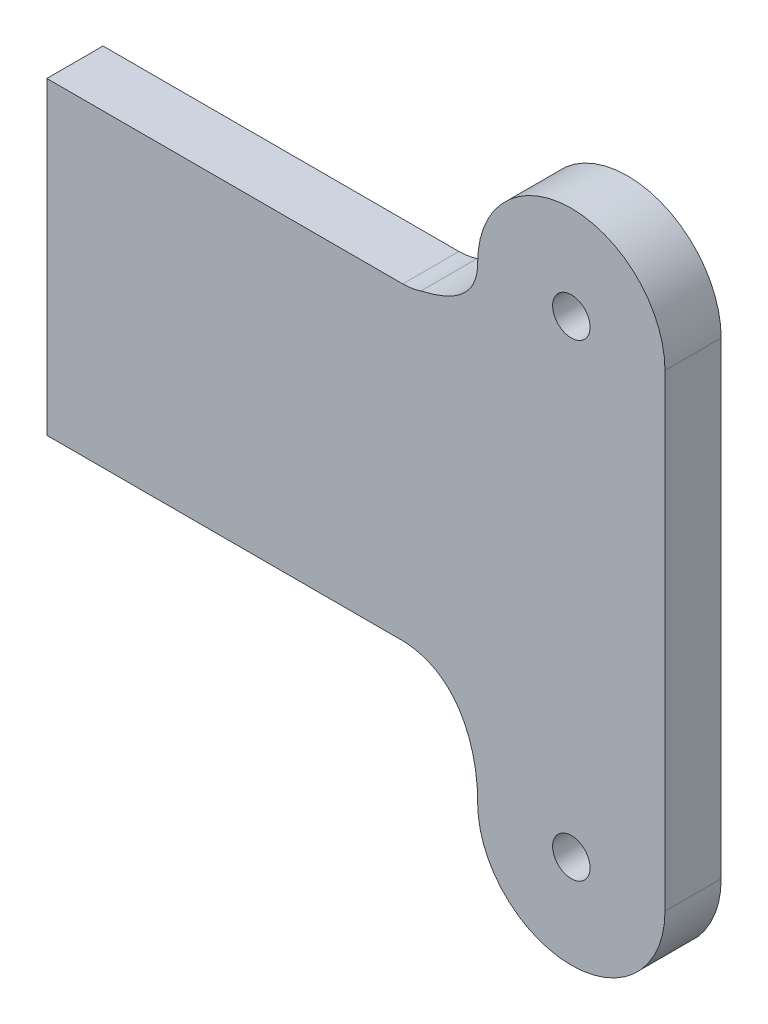
from build123d import *

# Parameters (mm, degrees)
SKETCH1_R           = 1
BOSS_EXTRUDE1_DEPTH = 3
SKETCH5_OUTSIDE_W   = 34.508
SKETCH5_OUTSIDE_H   = 45.508
SKETCH5_OUTSIDE_R   = 1
CUT_EXTRUDE2_DEPTH  = 10
SKETCH7_W           = 3
SKETCH7_H           = 10
SKETCH7_H_2         = 4
BOSS_EXTRUDE2_DEPTH = 10
BOSS_EXTRUDE3_REACH = 32.956
SKETCH8_W           = 22
SKETCH8_H           = 3


with BuildPart() as part:
    # Sketch1 → Boss-Extrude1 (new body)
    with BuildSketch(Plane.XY):
        with BuildLine():
            Line((0, 0), (0, -10))
            Line((0, -10), (9, -10))
            ThreePointArc((9, -10), (11.121320344, -10.878679656), (12, -13))
            Line((12, -13), (12, -17.5))
            ThreePointArc((12, -17.5), (12.878679656, -19.621320344), (15, -20.5))
            Line((15, -20.5), (21, -20.5))
            ThreePointArc((21, -20.5), (23.121320344, -19.621320344), (24, -17.5))
            Line((24, -17.5), (24, 11.5))
            ThreePointArc((24, 11.5), (23.121320344, 13.621320344), (21, 14.5))
            Line((21, 14.5), (15, 14.5))
            ThreePointArc((15, 14.5), (12.878679656, 13.621320344), (12, 11.5))
            Line((12, 11.5), (12, 9.5))
            ThreePointArc((12, 9.5), (11.121320344, 7.378679656), (9, 6.5))
            Line((9, 6.5), (0, 6.5))
            Line((0, 6.5), (0, 2.5))
            Line((0, 2.5), (12, 2.5))
            Line((12, 2.5), (12, 0))
            Line((12, 0), (0, 0))
        make_face()
        with Locations((18, -15.5)):
            Circle(SKETCH1_R, mode=Mode.SUBTRACT)
        with Locations((18, 9.5)):
            Circle(SKETCH1_R, mode=Mode.SUBTRACT)
    extrude(amount=BOSS_EXTRUDE1_DEPTH)

    # Sketch5 outside → Cut-Extrude2 (cut)
    # profile 1 of 3: a face of its own
    with BuildSketch(Plane.XY.offset(3)):
        with Locations((12, -3)):
            Rectangle(SKETCH5_OUTSIDE_W, SKETCH5_OUTSIDE_H)
        with BuildLine():
            Line((23, -15.5), (23, 9.5))
            ThreePointArc((23, 9.5), (18, 14.5), (13, 9.5))
            ThreePointArc((13, 9.5), (13.00003125, 9.482322297), (13.000125, 9.464644815))
            add(Edge.make_bspline(
                [(9.978094602, 6.663923317), (12.995350289, 7.319865218), (13.000125, 9.464644815)],
                knots=[0.130065152, 0.130065152, 0.130065152, 0.992908545, 0.992908545, 0.992908545], degree=2))
            ThreePointArc((9.978094602, 6.663923317), (9.495867902, 6.541264624), (9, 6.5))
            Line((9, 6.5), (0, 6.5))
            Line((0, 6.5), (0, 2.5))
            Line((0, 2.5), (12, 2.5))
            Line((12, 2.5), (12, 0))
            Line((12, 0), (0, 0))
            Line((0, 0), (0, -10))
            Line((0, -10), (9, -10))
            ThreePointArc((9, -10), (9.288075976, -10.013863327), (9.573489492, -10.055325179))
            add(Edge.make_bspline(
                [(13.000670773, -15.418101992), (13.007397522, -13.305169489), (12.200422908, -10.491068866), (9.573489492, -10.055325179)],
                knots=[0.011989502, 0.011989502, 0.011989502, 0.011989502, 0.935888971, 0.935888971, 0.935888971, 0.935888971], degree=3))
            add(Edge.make_bspline(
                [(13, -15.5), (13.000359156, -15.47282323), (13.00058348, -15.445521651), (13.000670773, -15.418101992)],
                knots=[0, 0, 0, 0, 0.011989502, 0.011989502, 0.011989502, 0.011989502], degree=3))
            ThreePointArc((13, -15.5), (18, -20.5), (23, -15.5))
        make_face(mode=Mode.SUBTRACT)
    # profile 2 of 3: a face of its own
    with BuildSketch(Plane.XY.offset(3)):
        with Locations((18, -15.5)):
            Circle(SKETCH5_OUTSIDE_R)
    # profile 3 of 3: a face of its own
    with BuildSketch(Plane.XY.offset(3)):
        with Locations((18, 9.5)):
            Circle(SKETCH5_OUTSIDE_R)
    extrude(amount=-CUT_EXTRUDE2_DEPTH, mode=Mode.SUBTRACT)

    # Sketch7 → Boss-Extrude2 (add)
    with BuildSketch(Plane.ZY):
        with Locations((1.5, -5)):
            Rectangle(SKETCH7_W, SKETCH7_H)
        with Locations((1.5, 4.5)):
            Rectangle(SKETCH7_W, SKETCH7_H_2)
    extrude(amount=BOSS_EXTRUDE2_DEPTH)

    # Sketch8 → Boss-Extrude3 (add, up to next)
    with BuildSketch(Plane(origin=(0, 0, 0), x_dir=(1, 0, 0), z_dir=(0, 1, 0)), mode=Mode.PRIVATE) as boss_extrude3_sk1:
        with Locations((1, -1.5)):
            Rectangle(SKETCH8_W, SKETCH8_H)
    boss_extrude3_tool1 = extrude(boss_extrude3_sk1.sketch, amount=BOSS_EXTRUDE3_REACH, mode=Mode.PRIVATE) - part.part
    add(boss_extrude3_tool1.solids().sort_by_distance((1, 0, 1.5))[0])


solid = part.part
